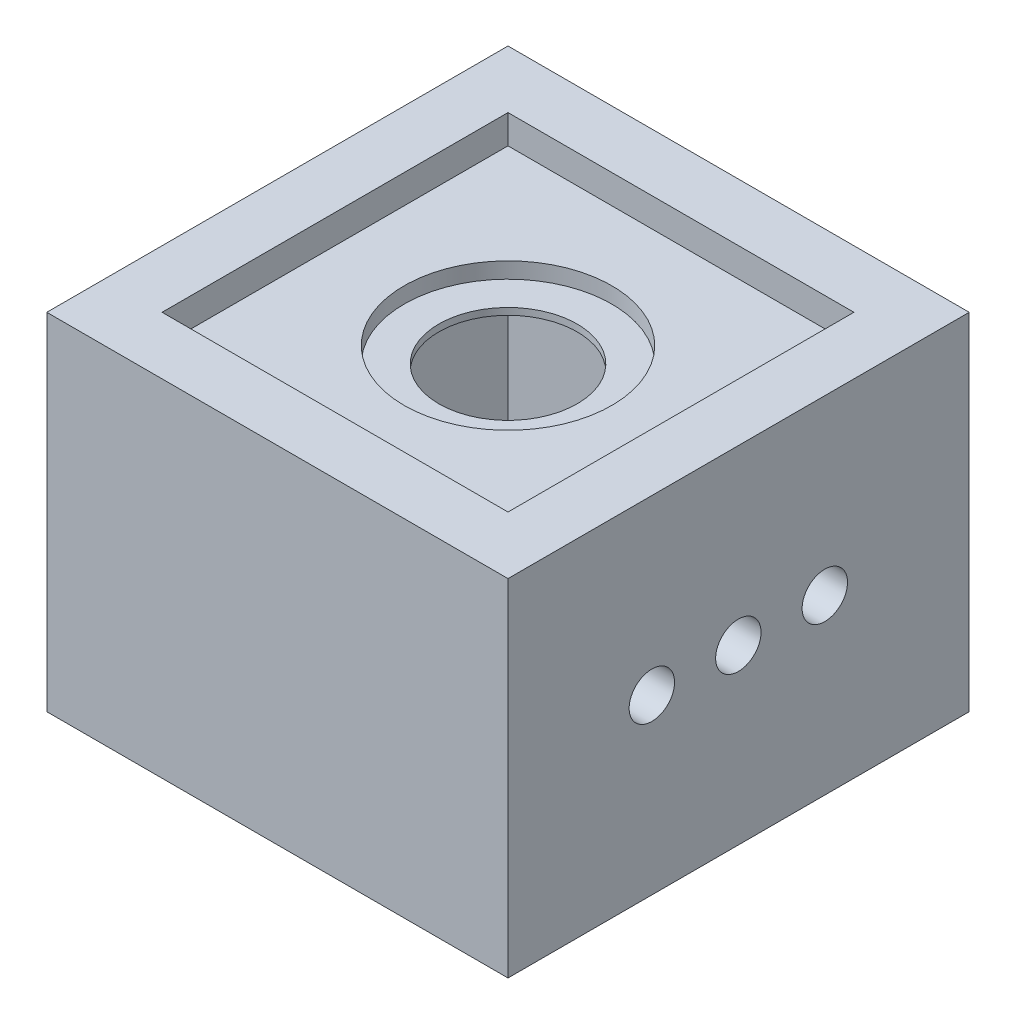
from build123d import *

# Parameters (mm, degrees)
SKETCH1_W           = 101.6
SKETCH1_H           = 101.6
SKETCH1_W_2         = 76.2
SKETCH1_H_2         = 76.2
BOSS_EXTRUDE1_DEPTH = 76.2
BOSS_EXTRUDE2_START = -6.35
SKETCH2_W           = 76.2
SKETCH2_H           = 76.2
SKETCH2_R           = 15.24
BOSS_EXTRUDE2_DEPTH = 5
SKETCH3_R           = 22.86
CUT_EXTRUDE2_DEPTH  = 3.5
SKETCH4_R           = 5
CUT_EXTRUDE3_DEPTH  = 12.7


with BuildPart() as part:
    # Sketch1 → Boss-Extrude1 (new body)
    with BuildSketch(Plane(origin=(0, 0, 0), x_dir=(1, 0, 0), z_dir=(0, 1, 0))):
        Rectangle(SKETCH1_W, SKETCH1_H)
        Rectangle(SKETCH1_W_2, SKETCH1_H_2, mode=Mode.SUBTRACT)
    extrude(amount=BOSS_EXTRUDE1_DEPTH)

    # Sketch2 → Boss-Extrude2 (add)
    with BuildSketch(Plane(origin=(0, 76.2, 0), x_dir=(1, 0, 0), z_dir=(0, 1, 0)).offset(BOSS_EXTRUDE2_START)):
        Rectangle(SKETCH2_W, SKETCH2_H)
        with Locations(Location((0, 0, 0), (0, 0, 270))):
            Circle(SKETCH2_R, mode=Mode.SUBTRACT)
    extrude(amount=-BOSS_EXTRUDE2_DEPTH)

    # Sketch3 → Cut-Extrude2 (cut)
    with BuildSketch(Plane(origin=(0, 69.85, 0), x_dir=(1, 0, 0), z_dir=(0, 1, 0))):
        with Locations(Location((0, 0, 0), (0, 0, 270))):
            Circle(SKETCH3_R)
    extrude(amount=-CUT_EXTRUDE2_DEPTH, mode=Mode.SUBTRACT)

    # Sketch4 → Cut-Extrude3 (cut)
    with BuildSketch(Plane(origin=(50.8, 0, 0), x_dir=(0, 0, -1), z_dir=(1, 0, 0))):
        with Locations((-19.110683009, 38.1)):
            Circle(SKETCH4_R)
        with Locations((-0.060683009, 38.1)):
            Circle(SKETCH4_R)
        with Locations((18.989316991, 38.1)):
            Circle(SKETCH4_R)
    extrude(amount=-CUT_EXTRUDE3_DEPTH, mode=Mode.SUBTRACT)


solid = part.part
